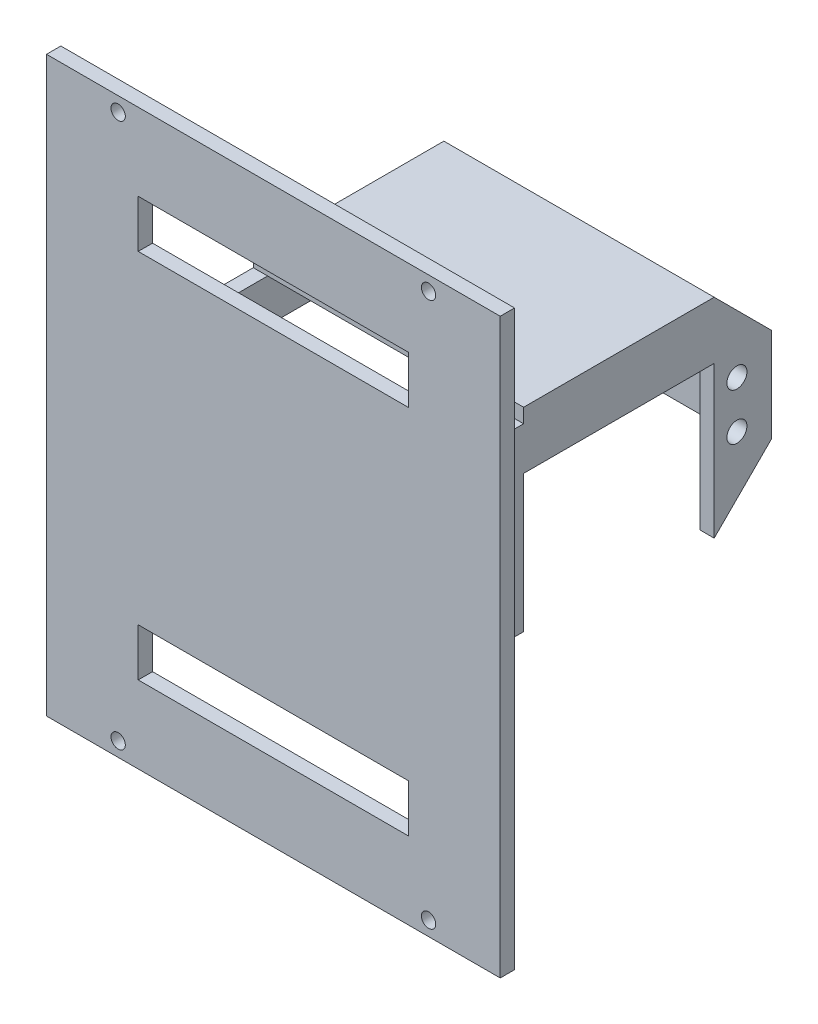
from build123d import *

# Parameters (mm, degrees)
SKETCH_1_W          = 95
SKETCH_1_H          = 120
EXTRUDE_1_DEPTH     = 3
SKETCH_2_W          = 3
SKETCH_2_H          = 37.7
EXTRUDE_2_DEPTH     = 70
SKETCH_3_W          = 39.9
SKETCH_3_H          = 19.7
SKETCH_3_R          = 2.1
CUT_EXTRUDE_1_DEPTH = 61
SKETCH_4_R          = 1.5
CUT_EXTRUDE_2_DEPTH = 10
SKETCH_5_W          = 56.6
SKETCH_5_H          = 19.7
EXTRUDE_3_DEPTH     = 3
SKETCH_6_W          = 56.6
SKETCH_6_H          = 39.9
EXTRUDE_4_DEPTH     = 3
EXTRUDE_5_DEPTH     = 3
SKETCH_9_W          = 12
SKETCH_9_H          = 12
EXTRUDE_6_DEPTH     = 3
SKETCH_10_W         = 39.9
SKETCH_10_H         = 9
CUT_EXTRUDE_4_DEPTH = 74
SKETCH_13_W         = 56.6
SKETCH_13_H         = 10
CUT_EXTRUDE_5_DEPTH = 14


with BuildPart() as part:
    # 草图1 → 凸台-拉伸1 (new body)
    with BuildSketch(Plane.XY):
        with Locations((-42.5, 0.779220779)):
            Rectangle(SKETCH_1_W, SKETCH_1_H)
    extrude(amount=EXTRUDE_1_DEPTH)

    # 草图2 → 凸台-拉伸2 (add)
    with BuildSketch(Plane(origin=(0, 0, 0), x_dir=(-1, 0, 0), z_dir=(0, 0, -1))):
        with Locations((15.7, 0.779220779)):
            Rectangle(SKETCH_2_W, SKETCH_2_H)
        with Locations((69.3, 0.779220779)):
            Rectangle(SKETCH_2_W, SKETCH_2_H)
    extrude(amount=EXTRUDE_2_DEPTH)

    # 草图3 → 切除-拉伸1 (cut)
    with BuildSketch(Plane(origin=(-14.2, 0, 0), x_dir=(0, 0, -1), z_dir=(1, 0, 0))):
        with Locations((41.05, 0.779220779)):
            Rectangle(SKETCH_3_W, SKETCH_3_H)
        with Locations((16.34, -4.145779221)):
            Circle(SKETCH_3_R)
        with Locations((65.76, 5.704220779)):
            Circle(SKETCH_3_R)
        with Locations((65.76, -4.145779221)):
            Circle(SKETCH_3_R)
        with Locations((16.34, 5.704220779)):
            Circle(SKETCH_3_R)
    extrude(amount=-CUT_EXTRUDE_1_DEPTH, mode=Mode.SUBTRACT)

    # 草图4 → 切除-拉伸2 (cut)
    with BuildSketch(Plane.XY.offset(3)):
        with Locations((-75, 57.779220779)):
            Circle(SKETCH_4_R)
        with Locations(Location((-10, 57.779220779, 0), (0, 0, 180))):
            Circle(SKETCH_4_R)
        with Locations((-10, -56.220779221)):
            Circle(SKETCH_4_R)
        with Locations(Location((-75, -56.220779221, 0), (0, 0, 180))):
            Circle(SKETCH_4_R)
    extrude(amount=-CUT_EXTRUDE_2_DEPTH, mode=Mode.SUBTRACT)

    # 草图5 → 凸台-拉伸3 (add)
    with BuildSketch(Plane(origin=(0, 0, -70), x_dir=(-1, 0, 0), z_dir=(0, 0, -1))):
        with Locations((42.5, 0.779220779)):
            Rectangle(SKETCH_5_W, SKETCH_5_H)
    extrude(amount=EXTRUDE_3_DEPTH)

    # 草图6 → 凸台-拉伸4 (add)
    with BuildSketch(Plane(origin=(0, 19.629220779, 0), x_dir=(1, 0, 0), z_dir=(0, 1, 0))):
        with Locations((-42.5, 41.05)):
            Rectangle(SKETCH_6_W, SKETCH_6_H)
    extrude(amount=EXTRUDE_4_DEPTH)

    # 草图8 → 凸台-拉伸5 (add)
    with BuildSketch(Plane(origin=(-14.2, 0, 0), x_dir=(0, 0, -1), z_dir=(1, 0, 0))):
        Polygon((61, 22.629220779), (61, 19.629220779), (70, 19.629220779), (70, 10.629220779), (73, 10.629220779), (73, 22.629220779), align=None)
        Polygon((73, -9.070779221), (70, -9.070779221), (70, -18.070779221), (61, -18.070779221), (61, -21.070779221), (73, -21.070779221), align=None)
    extrude(amount=-EXTRUDE_5_DEPTH)

    # 草图9 → 凸台-拉伸6 (add)
    with BuildSketch(Plane.ZY.offset(70.8)):
        with Locations((-67, 16.629220779)):
            Rectangle(SKETCH_9_W, SKETCH_9_H)
        with Locations((-67, -15.070779221)):
            Rectangle(SKETCH_9_W, SKETCH_9_H)
    extrude(amount=-EXTRUDE_6_DEPTH)

    # 草图10 → 切除-拉伸4 (cut)
    with BuildSketch(Plane(origin=(-14.2, 0, 0), x_dir=(0, 0, -1), z_dir=(1, 0, 0))):
        Polygon((73, 10.629220779), (73, 22.629220779), (61, 22.629220779), align=None)
        Polygon((73, -9.070779221), (73, -21.070779221), (61, -21.070779221), align=None)
        with Locations((41.05, -13.570779221)):
            Rectangle(SKETCH_10_W, SKETCH_10_H)
    extrude(amount=-CUT_EXTRUDE_4_DEPTH, mode=Mode.SUBTRACT)

    # 草图13 → 切除-拉伸5 (cut)
    with BuildSketch(Plane(origin=(0, 0, 0), x_dir=(-1, 0, 0), z_dir=(0, 0, -1))):
        with Locations((42.5, 39.629220779)):
            Rectangle(SKETCH_13_W, SKETCH_13_H)
        with Locations((42.5, -38.070779221)):
            Rectangle(SKETCH_13_W, SKETCH_13_H)
    extrude(amount=-CUT_EXTRUDE_5_DEPTH, mode=Mode.SUBTRACT)


solid = part.part
